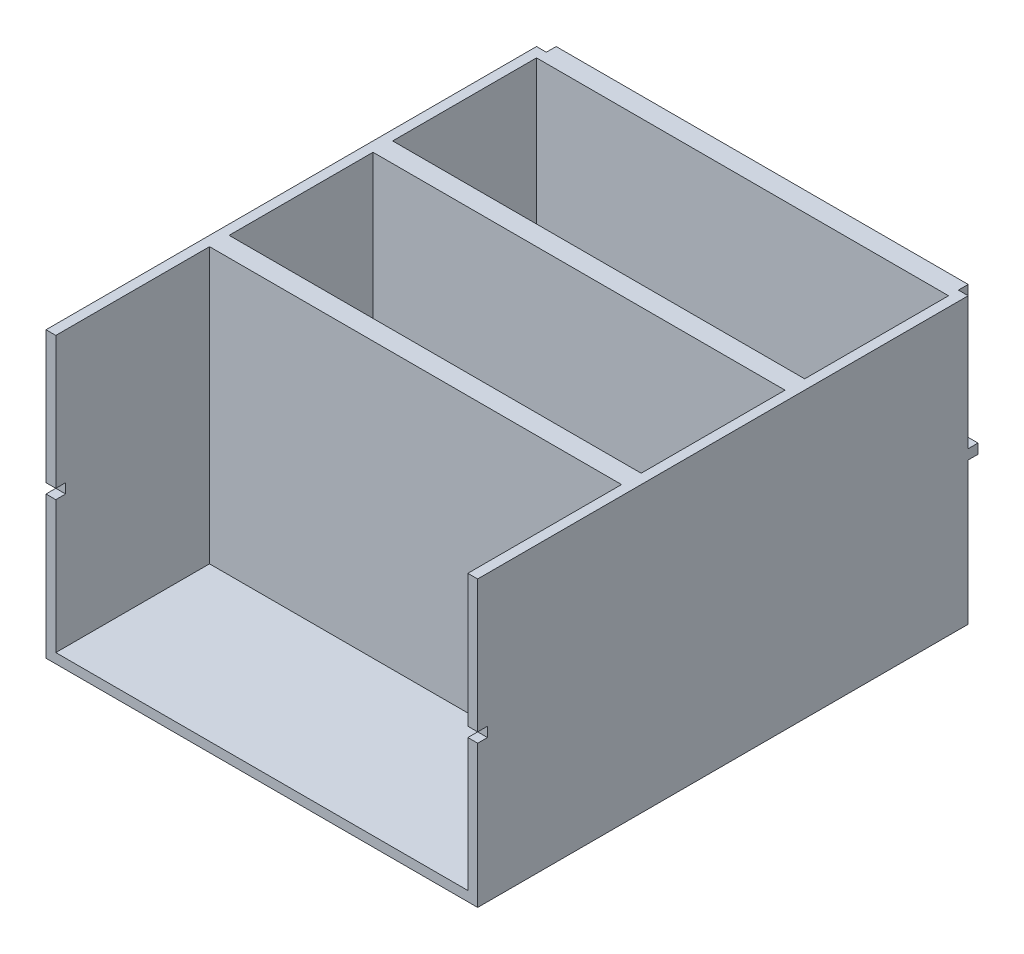
from build123d import *

# Parameters (mm, degrees)
SKETCH1_W           = 220
SKETCH1_H           = 250
BOSS_EXTRUDE1_DEPTH = 5
SKETCH2_W           = 220
SKETCH2_H           = 250
SKETCH2_W_2         = 210
SKETCH2_H_2         = 73.333333333
SKETCH2_H_3         = 73.333333334
BOSS_EXTRUDE2_DEPTH = 140
SKETCH3_W           = 5
SKETCH3_H           = 5
CUT_EXTRUDE1_DEPTH  = 5
BOSS_EXTRUDE3_START = -5
BOSS_EXTRUDE3_DEPTH = 5


with BuildPart() as part:
    # Sketch1 → Boss-Extrude1 (new body)
    with BuildSketch(Plane(origin=(0, 0, 0), x_dir=(1, 0, 0), z_dir=(0, 1, 0))):
        Rectangle(SKETCH1_W, SKETCH1_H)
    extrude(amount=BOSS_EXTRUDE1_DEPTH)

    # Sketch2 → Boss-Extrude2 (add)
    with BuildSketch(Plane(origin=(0, 5, 0), x_dir=(1, 0, 0), z_dir=(0, 1, 0))):
        Rectangle(SKETCH2_W, SKETCH2_H)
        with Locations((0, 83.333333334)):
            Rectangle(SKETCH2_W_2, SKETCH2_H_2, mode=Mode.SUBTRACT)
        with Locations((0, -83.333333334)):
            Rectangle(SKETCH2_W_2, SKETCH2_H_2, mode=Mode.SUBTRACT)
        Rectangle(SKETCH2_W_2, SKETCH2_H_3, mode=Mode.SUBTRACT)
    extrude(amount=BOSS_EXTRUDE2_DEPTH)

    # Sketch3 → Cut-Extrude1 (cut)
    with BuildSketch(Plane.XY.offset(125)):
        Polygon((-105, 145), (-105, 77.5), (-105, 72.5), (-105, 5), (105, 5), (105, 72.5), (105, 77.5), (105, 145), align=None)
        with Locations((107.5, 75)):
            Rectangle(SKETCH3_W, SKETCH3_H)
        with Locations((-107.5, 75)):
            Rectangle(SKETCH3_W, SKETCH3_H)
    extrude(amount=-CUT_EXTRUDE1_DEPTH, mode=Mode.SUBTRACT)

    # Sketch4 → Boss-Extrude3 (add)
    with BuildSketch(Plane.XY.offset(-120).offset(BOSS_EXTRUDE3_START)):
        Polygon((105, 145), (-105, 145), (-105, 77.5), (-110, 77.5), (-110, 72.5), (-105, 72.5), (-105, 5), (105, 5), (105, 72.5), (110, 72.5), (110, 77.5), (105, 77.5), align=None)
    extrude(amount=-BOSS_EXTRUDE3_DEPTH)


solid = part.part
